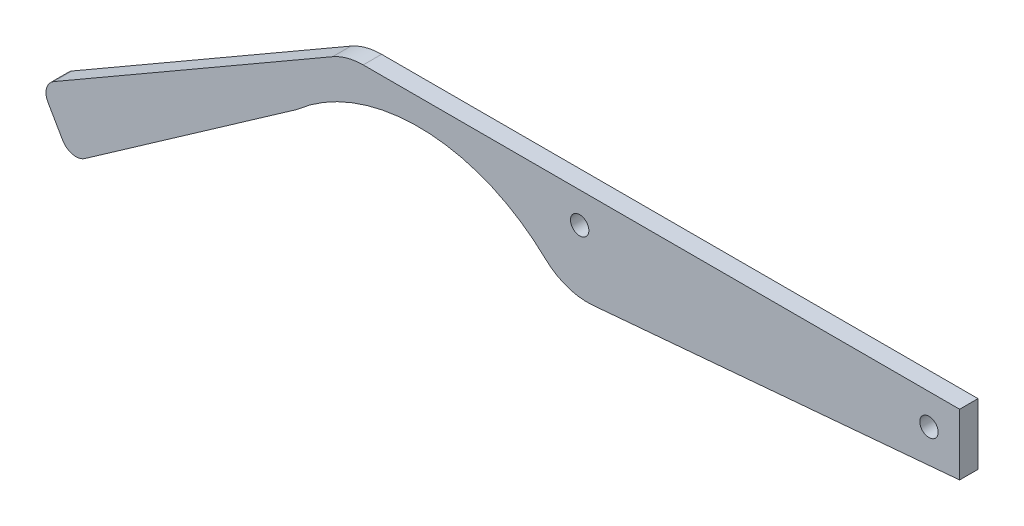
from build123d import *

# Parameters (mm, degrees)
BOSS_EXTRUDE1_DEPTH = 3
SKETCH2_R           = 1.5
CUT_EXTRUDE1_DEPTH  = 10


with BuildPart() as part:
    # Sketch1 → Boss-Extrude1 (new body)
    with BuildSketch(Plane.XY):
        with BuildLine():
            Line((0, 0), (-97.320508076, 0))
            ThreePointArc((-97.320508076, 0), (-99.908698527, -0.340741737), (-102.320508076, -1.339745962))
            Line((-102.320508076, -1.339745962), (-147.834936491, -27.617513459))
            ThreePointArc((-147.834936491, -27.617513459), (-148.999751056, -29.135529356), (-148.75, -31.032576969))
            Line((-148.75, -31.032576969), (-146.364135626, -35.165015284))
            ThreePointArc((-146.364135626, -35.165015284), (-144.740171152, -36.355755302), (-142.765131026, -35.962895395))
            Line((-142.765131026, -35.962895395), (-108.249632243, -11.794882962))
            ThreePointArc((-108.249632243, -11.794882962), (-108.142543563, -11.71556254), (-108.039833804, -11.630648348))
            ThreePointArc((-108.039833804, -11.630648348), (-87.659186574, -4.241562471), (-67.620976195, -12.514379188))
            ThreePointArc((-67.620976195, -12.514379188), (-64.029298108, -14.71197301), (-59.851424349, -15.236321126))
            Line((-59.851424349, -15.236321126), (0, -10))
            Line((0, -10), (0, 0))
        make_face()
    extrude(amount=BOSS_EXTRUDE1_DEPTH)

    # Sketch2 → Cut-Extrude1 (cut)
    with BuildSketch(Plane(origin=(0, 0, 0), x_dir=(-1, 0, 0), z_dir=(0, 0, -1))):
        with Locations((5, -5)):
            Circle(SKETCH2_R)
        with Locations((62, -5)):
            Circle(SKETCH2_R)
    extrude(amount=-CUT_EXTRUDE1_DEPTH, mode=Mode.SUBTRACT)


solid = part.part
